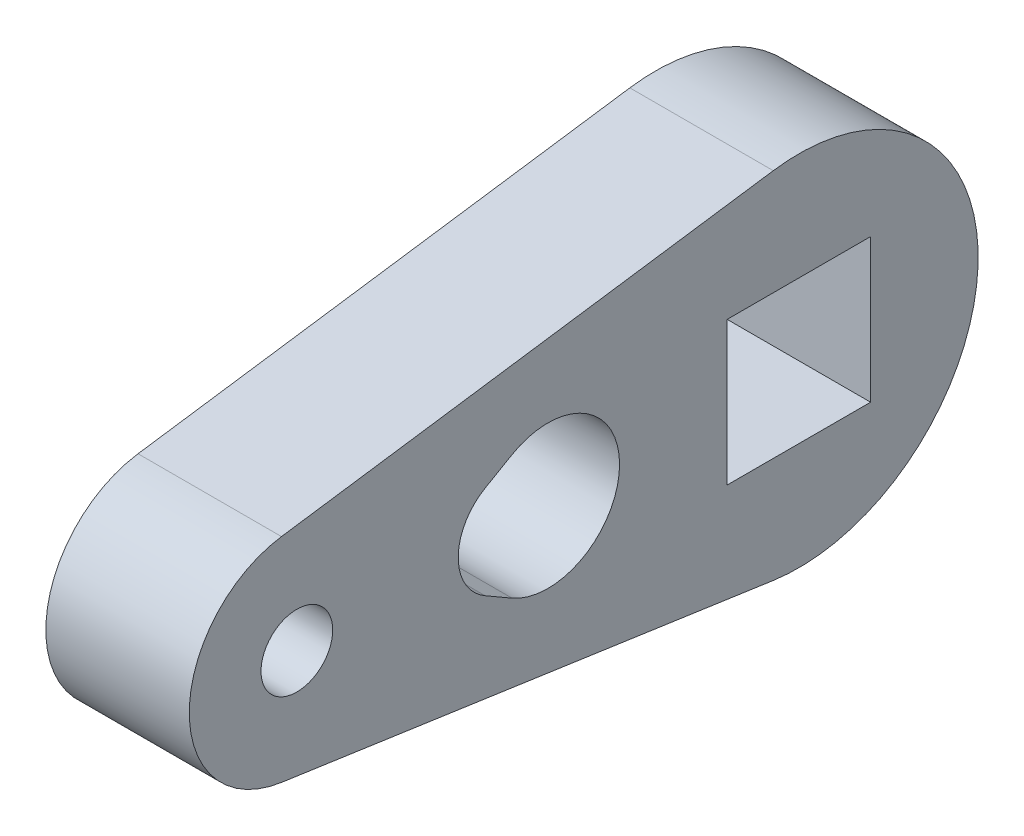
from build123d import *

# Parameters (mm, degrees)
SKETCH_1_R      = 2
SKETCH_1_W      = 8
SKETCH_1_H      = 8
EXTRUDE_1_DEPTH = 4


with BuildPart() as part:
    # 草图1 → 凸台-拉伸1 (new, symmetric)
    with BuildSketch(Plane(origin=(0, 0, 0), x_dir=(0, 0, -1), z_dir=(1, 0, 0))):
        with BuildLine():
            Line((-28.857142857, 5.938459912), (-1.428571429, 9.897433186))
            ThreePointArc((-1.428571429, 9.897433186), (10, 0), (-1.428571429, -9.897433186))
            Line((-1.428571429, -9.897433186), (-28.857142857, -5.938459912))
            ThreePointArc((-28.857142857, -5.938459912), (-34, 0), (-28.857142857, 5.938459912))
        make_face()
        with Locations((-28, 0)):
            Circle(SKETCH_1_R, mode=Mode.SUBTRACT)
        Rectangle(SKETCH_1_W, SKETCH_1_H, mode=Mode.SUBTRACT)
        with BuildLine():
            Line((-17.5, 2.598076211), (-16, 3.464101615))
            ThreePointArc((-16, 3.464101615), (-10, 0), (-16, -3.464101615))
            Line((-16, -3.464101615), (-17.5, -2.598076211))
            ThreePointArc((-17.5, -2.598076211), (-19, 0), (-17.5, 2.598076211))
        make_face(mode=Mode.SUBTRACT)
    extrude(amount=EXTRUDE_1_DEPTH, both=True)


solid = part.part
